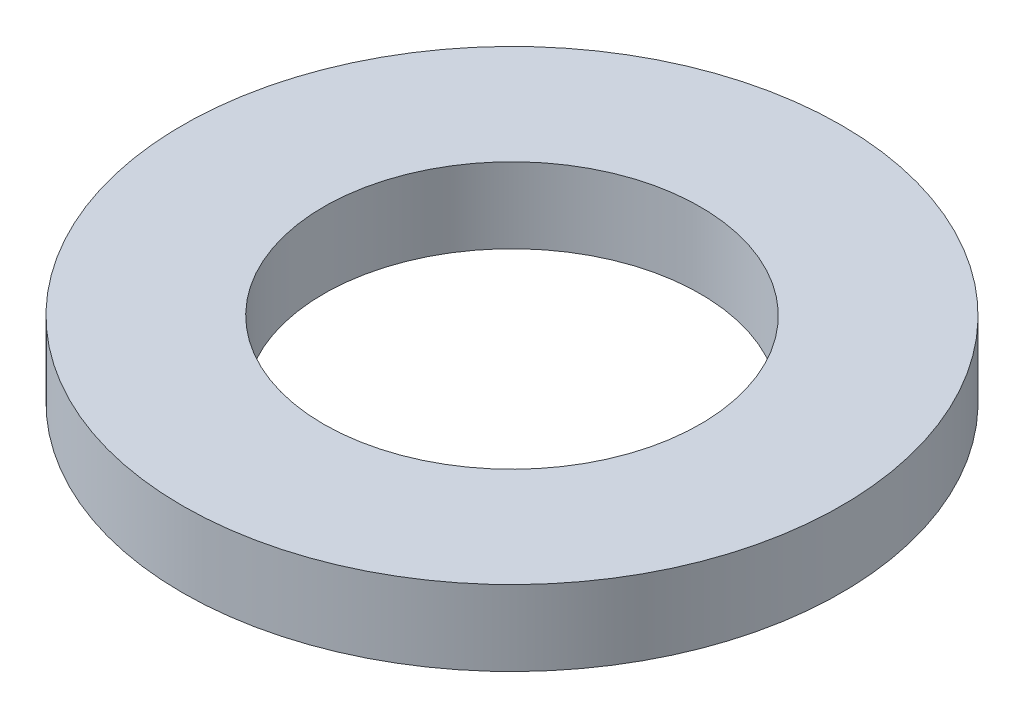
from build123d import *

# Parameters (mm, degrees)
SKETCH1_R           = 17.5
SKETCH1_R_2         = 10
BOSS_EXTRUDE1_DEPTH = 4


with BuildPart() as part:
    # Sketch1 → Boss-Extrude1 (new body)
    with BuildSketch(Plane(origin=(0, 0, 0), x_dir=(1, 0, 0), z_dir=(0, 1, 0))):
        with Locations(Location((0, 0, 0), (0, 0, 270))):
            Circle(SKETCH1_R)
        with Locations(Location((0, 0, 0), (0, 0, 270))):
            Circle(SKETCH1_R_2, mode=Mode.SUBTRACT)
    extrude(amount=BOSS_EXTRUDE1_DEPTH)


solid = part.part
